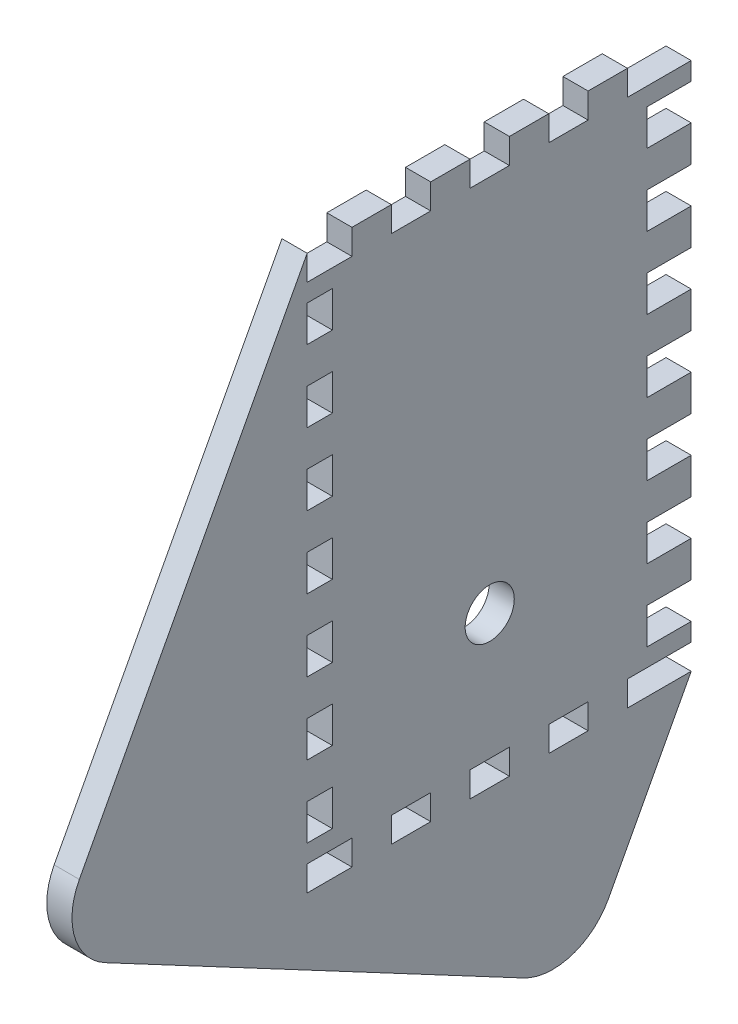
from build123d import *

# Parameters (mm, degrees)
SCHIZZO1_W                   = 50
SCHIZZO1_H                   = 80
ESTRUSIONE_ESTRUSIONE1_DEPTH = 4
SCHIZZO2_W                   = 4
SCHIZZO2_H                   = 2.857142857
SCHIZZO2_W_2                 = 7
ESTRUSIONE_ESTRUSIONE2_DEPTH = 4
SCHIZZO3_W                   = 4
SCHIZZO3_H                   = 5.714285715
SCHIZZO3_W_2                 = 7
ESTRUSIONE_ESTRUSIONE3_DEPTH = 4
RIPETIZIONE_A_L1_COUNT       = 6
RIPETIZIONE_A_L1_PITCH       = 11.428571
SCHIZZO4_W                   = 6.25
SCHIZZO4_H                   = 4
ESTRUSIONE_ESTRUSIONE4_DEPTH = 4
RIPETIZIONE_A_L2_COUNT       = 4
RIPETIZIONE_A_L2_PITCH       = 12.5
ESTRUSIONE_ESTRUSIONE5_DEPTH = 4
RACCORDO1_R                  = 10
SCHIZZO6_R                   = 3.9
TAGLIO_ESTRUSIONE1_DEPTH     = 4


with BuildPart() as part:
    # Schizzo1 → Estrusione-Estrusione1 (new body)
    with BuildSketch(Plane(origin=(0, 0, 0), x_dir=(0, 0, -1), z_dir=(1, 0, 0))):
        with Locations((25, 40)):
            Rectangle(SCHIZZO1_W, SCHIZZO1_H)
    extrude(amount=ESTRUSIONE_ESTRUSIONE1_DEPTH)

    # Schizzo2 → Estrusione-Estrusione2 (add)
    with BuildSketch(Plane(origin=(4, 0, 0), x_dir=(0, 0, -1), z_dir=(1, 0, 0))):
        with Locations((-2, 78.571428572)):
            Rectangle(SCHIZZO2_W, SCHIZZO2_H)
        with Locations((53.5, 78.571428572)):
            Rectangle(SCHIZZO2_W_2, SCHIZZO2_H)
        with Locations((53.5, 1.428571429)):
            Rectangle(SCHIZZO2_W_2, SCHIZZO2_H)
        with Locations((-2, 1.428571429)):
            Rectangle(SCHIZZO2_W, SCHIZZO2_H)
    extrude(amount=-ESTRUSIONE_ESTRUSIONE2_DEPTH)

    # Schizzo3 → Estrusione-Estrusione3 (add)
    with BuildSketch(Plane(origin=(4, 0, 0), x_dir=(0, 0, -1), z_dir=(1, 0, 0))):
        with Locations((-2, 68.571428572)):
            Rectangle(SCHIZZO3_W, SCHIZZO3_H)
        with Locations((53.5, 68.571428572)):
            Rectangle(SCHIZZO3_W_2, SCHIZZO3_H)
    estrusione_estrusione3 = extrude(amount=-ESTRUSIONE_ESTRUSIONE3_DEPTH)

    # Ripetizione a L1: Estrusione-Estrusione3 ×6
    with Locations(*[(0, -i * RIPETIZIONE_A_L1_PITCH, 0) for i in range(1, RIPETIZIONE_A_L1_COUNT)]):
        add(estrusione_estrusione3)

    # Schizzo4 → Estrusione-Estrusione4 (add)
    with BuildSketch(Plane(origin=(4, 0, 0), x_dir=(0, 0, -1), z_dir=(1, 0, 0))):
        with Locations((6.25, 82)):
            Rectangle(SCHIZZO4_W, SCHIZZO4_H)
        with Locations((6.25, -2)):
            Rectangle(SCHIZZO4_W, SCHIZZO4_H)
    estrusione_estrusione4 = extrude(amount=-ESTRUSIONE_ESTRUSIONE4_DEPTH)

    # Ripetizione a L2: Estrusione-Estrusione4 ×4
    with Locations(*[(0, 0, -i * RIPETIZIONE_A_L2_PITCH) for i in range(1, RIPETIZIONE_A_L2_COUNT)]):
        add(estrusione_estrusione4)

    # Schizzo5 → Estrusione-Estrusione5 (add)
    with BuildSketch(Plane(origin=(4, 0, 0), x_dir=(0, 0, -1), z_dir=(1, 0, 0))):
        Polygon((46.875, -4), (57, -4), (39.160080614, -37.552008529), (-44.872956134, 7.129149682), (-4, 84), (-4, 80), (-4, -4), align=None)
    extrude(amount=-ESTRUSIONE_ESTRUSIONE5_DEPTH)

    # Raccordo1
    raccordo1_edges = [part.edges().sort_by_distance(p)[0] for p in [
        (2, -37.552008529, -39.160080614),
        (2, 7.129149682, 44.872956134),
    ]]
    fillet(raccordo1_edges, radius=RACCORDO1_R)

    # Schizzo6 → Taglio-Estrusione1 (cut)
    with BuildSketch(Plane(origin=(4, 0, 0), x_dir=(0, 0, -1), z_dir=(1, 0, 0))):
        with Locations((25, 20)):
            Circle(SCHIZZO6_R)
    extrude(amount=-TAGLIO_ESTRUSIONE1_DEPTH, mode=Mode.SUBTRACT)


solid = part.part
